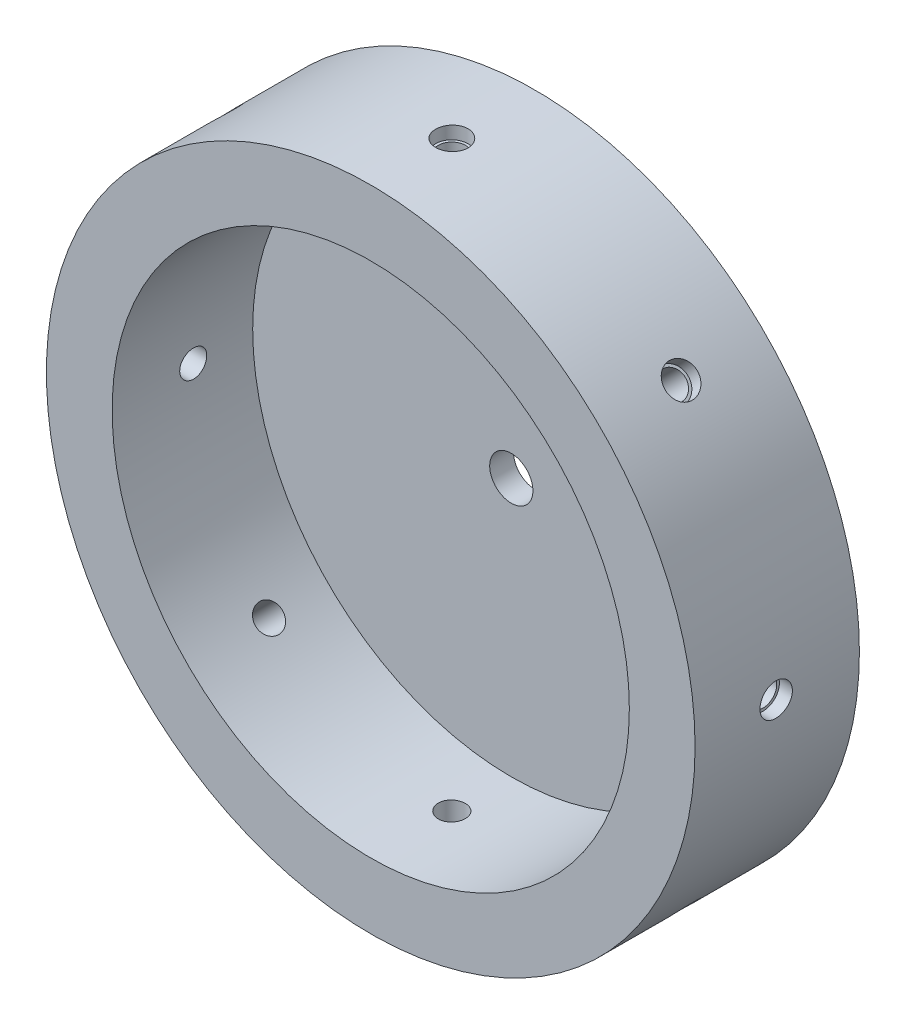
from build123d import *

# Parameters (mm, degrees)
SKETCH2_R                = 150
SKETCH2_R_2              = 119.6
BOSS_EXTRUDE1_DEPTH      = 75
BOSS_EXTRUDE2_DEPTH      = 1
BOSS_EXTRUDE2_DEPTH_BACK = 10
SKETCH3_R                = 150
SKETCH3_R_2              = 10
SKETCH4_R                = 7.5
CUT_EXTRUDE4_DEPTH       = 6
SKETCH7_R                = 6.25
CUT_EXTRUDE5_DEPTH       = 50
CIRPATTERN1_COUNT        = 8


with BuildPart() as part:
    # Sketch2 → Boss-Extrude1 (new body)
    with BuildSketch(Plane.XY):
        Circle(SKETCH2_R)
        Circle(SKETCH2_R_2, mode=Mode.SUBTRACT)
    extrude(amount=-BOSS_EXTRUDE1_DEPTH)

    # Sketch3 → Boss-Extrude2 (add, two sides: drawn at the far end of the back side and taken through both)
    with BuildSketch(Plane(origin=(0, 0, -75), x_dir=(-1, 0, 0), z_dir=(0, 0, -1)).offset(-BOSS_EXTRUDE2_DEPTH_BACK)):
        with Locations(Location((0, 0, 0), (0, 0, 180))):
            Circle(SKETCH3_R)
        Circle(SKETCH3_R_2, mode=Mode.SUBTRACT)
    extrude(amount=BOSS_EXTRUDE2_DEPTH + BOSS_EXTRUDE2_DEPTH_BACK)

    # Sketch4 → Cut-Extrude4 (cut)
    with BuildSketch(Plane(origin=(0, -150, 0), x_dir=(1, 0, 0), z_dir=(0, 1, 0))):
        with Locations(Location((0, 37.5, 0), (0, 0, 90))):
            Circle(SKETCH4_R)
    cut_extrude4 = extrude(amount=CUT_EXTRUDE4_DEPTH, mode=Mode.SUBTRACT)

    # Sketch7 → Cut-Extrude5 (cut)
    with BuildSketch(Plane.XZ.offset(144)):
        with Locations(Location((0, -37.5, 0), (0, 0, 270))):
            Circle(SKETCH7_R)
    cut_extrude5 = extrude(amount=-CUT_EXTRUDE5_DEPTH, mode=Mode.SUBTRACT)

    # CirPattern1: Cut-Extrude4, Cut-Extrude5 ×8 about axis
    cirpattern1_axis = Axis((0, 0, 0), (0, 0, 1))
    add([cut_extrude4.rotate(cirpattern1_axis, i * 360 / CIRPATTERN1_COUNT) for i in range(1, CIRPATTERN1_COUNT)], mode=Mode.SUBTRACT)
    add([cut_extrude5.rotate(cirpattern1_axis, i * 360 / CIRPATTERN1_COUNT) for i in range(1, CIRPATTERN1_COUNT)], mode=Mode.SUBTRACT)


solid = part.part
